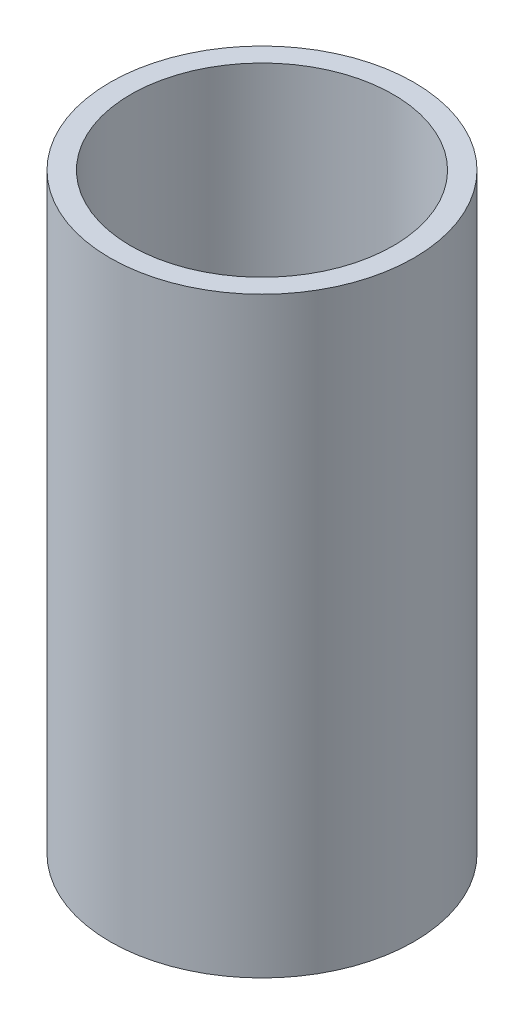
from build123d import *

# Parameters (mm, degrees)
SKETCH1_R           = 4.75
SKETCH1_R_2         = 4.1
BOSS_EXTRUDE1_DEPTH = 18.5


with BuildPart() as part:
    # Sketch1 → Boss-Extrude1 (new body)
    with BuildSketch(Plane(origin=(0, 0, 0), x_dir=(1, 0, 0), z_dir=(0, 1, 0))):
        with Locations(Location((0, 0, 0), (0, 0, 270))):
            Circle(SKETCH1_R)
        with Locations(Location((0, 0, 0), (0, 0, 270))):
            Circle(SKETCH1_R_2, mode=Mode.SUBTRACT)
    extrude(amount=BOSS_EXTRUDE1_DEPTH)


solid = part.part
